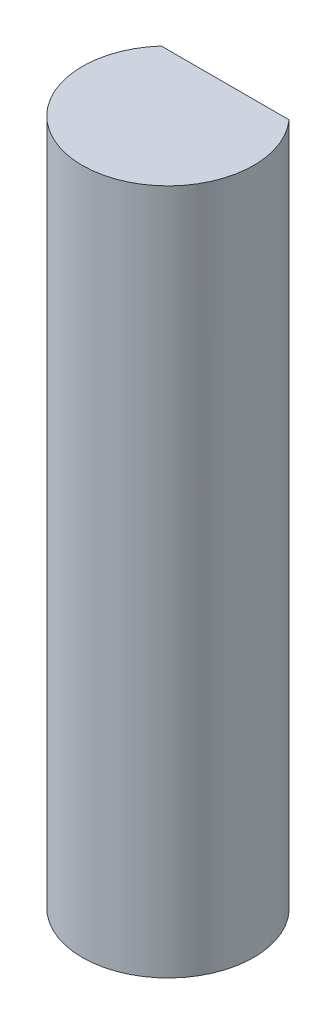
from build123d import *

# Parameters (mm, degrees)
SKETCH_1_R          = 1.5
EXTRUDE_1_DEPTH     = 10
CUT_EXTRUDE_START   = -10
CUT_EXTRUDE_1_DEPTH = 10
BOSS_EXTRUDE1_START = 2
SKETCH1_R           = 1.5
BOSS_EXTRUDE1_DEPTH = 2


with BuildPart() as part:
    # 草图1 → 凸台-拉伸1 (new body)
    with BuildSketch(Plane(origin=(0, 0, 0), x_dir=(1, 0, 0), z_dir=(0, 1, 0))):
        with Locations(Location((0, 0, 0), (0, 0, 270))):
            Circle(SKETCH_1_R)
    extrude(amount=EXTRUDE_1_DEPTH)

    # 草图2 → 切除-拉伸1 (cut)
    with BuildSketch(Plane(origin=(0, 10, 0), x_dir=(1, 0, 0), z_dir=(0, 1, 0)).offset(CUT_EXTRUDE_START)):
        with BuildLine():
            Line((-1.118033989, 1), (1.118033989, 1))
            ThreePointArc((1.118033989, 1), (0, 1.5), (-1.118033989, 1))
        make_face()
    extrude(amount=CUT_EXTRUDE_1_DEPTH, mode=Mode.SUBTRACT)

    # Sketch1 → Boss-Extrude1 (add)
    with BuildSketch(Plane.XZ.offset(BOSS_EXTRUDE1_START)):
        with Locations(Location((0, 0, 0), (0, 0, 270))):
            Circle(SKETCH1_R)
    extrude(amount=-BOSS_EXTRUDE1_DEPTH)


solid = part.part
